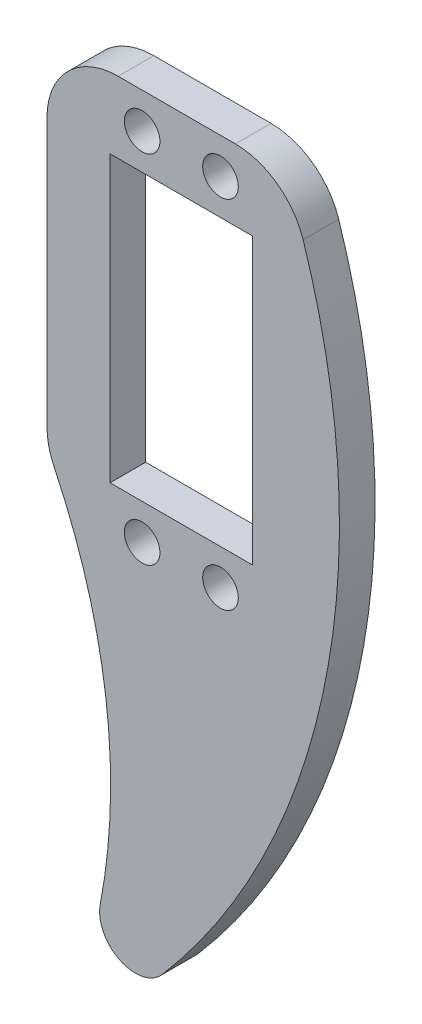
from build123d import *

# Parameters (mm, degrees)
ESQUISSE1_W             = 20
ESQUISSE1_H             = 40
BOSS_EXTRU_1_DEPTH      = 5
CONG_1_R                = 10
CONG_2_R                = 10
ESQUISSE2_R             = 2.5
ENL_V_MAT_EXTRU_1_DEPTH = 10


with BuildPart() as part:
    # Esquisse1 → Boss.-Extru.1 (new body)
    with BuildSketch(Plane.XY):
        with BuildLine():
            Line((-8.855638783, 10), (24.569838787, 10))
            ThreePointArc((24.569838787, 10), (30.866124306, -45.477583457), (7.330413731, -96.108362687))
            ThreePointArc((7.330413731, -96.108362687), (1.361276776, -97.354484204), (-1.373289466, -91.904203266))
            ThreePointArc((-1.373289466, -91.904203266), (-0.740706025, -65.321594201), (-8.855638783, -40))
            Line((-8.855638783, -40), (-8.855638783, 10))
        make_face()
        with Locations((10, -20)):
            Rectangle(ESQUISSE1_W, ESQUISSE1_H, mode=Mode.SUBTRACT)
    extrude(amount=BOSS_EXTRU_1_DEPTH)

    # Congé1
    cong_1_edges = [part.edges().sort_by_distance(p)[0] for p in [
        (24.569838787, 10, 2.5),
    ]]
    fillet(cong_1_edges, radius=CONG_1_R)

    # Congé2
    cong_2_edges = [part.edges().sort_by_distance(p)[0] for p in [
        (-8.855638783, -40, 2.5),
        (-8.855638783, 10, 2.5),
    ]]
    fillet(cong_2_edges, radius=CONG_2_R)

    # Esquisse2 → Enlèv. mat.-Extru.1 (cut)
    with BuildSketch(Plane.XY.offset(5)):
        with Locations((4.5, 5)):
            Circle(ESQUISSE2_R)
        with Locations((15.5, 5)):
            Circle(ESQUISSE2_R)
        with Locations((4.5, -45)):
            Circle(ESQUISSE2_R)
        with Locations((15.5, -45)):
            Circle(ESQUISSE2_R)
    extrude(amount=-ENL_V_MAT_EXTRU_1_DEPTH, mode=Mode.SUBTRACT)


solid = part.part
